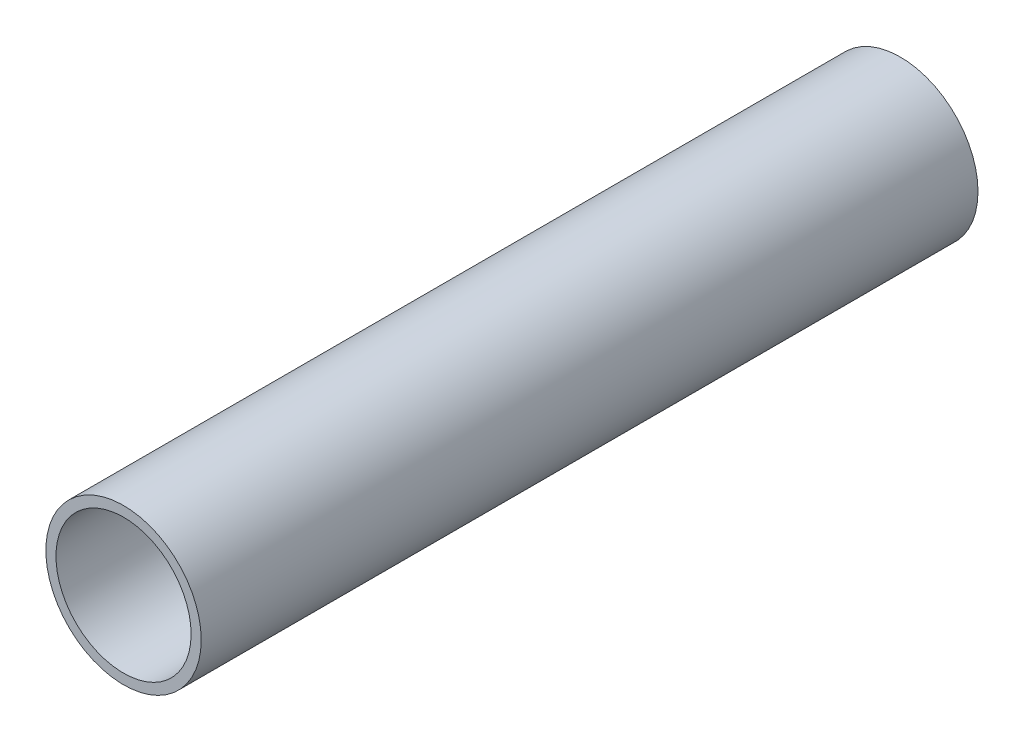
from build123d import *

# Parameters (mm, degrees)
BOSS_EXTRUDE1_DEPTH      = 50.8
BOSS_EXTRUDE1_DEPTH_BACK = 76.2
SKETCH3_R                = 12.7
SKETCH3_R_2              = 11.049


with BuildPart() as part:
    # Sketch3 → Boss-Extrude1 (new, two sides: drawn at the far end of the back side and taken through both)
    with BuildSketch(Plane.XY.offset(-BOSS_EXTRUDE1_DEPTH_BACK)):
        Circle(SKETCH3_R)
        Circle(SKETCH3_R_2, mode=Mode.SUBTRACT)
    extrude(amount=BOSS_EXTRUDE1_DEPTH + BOSS_EXTRUDE1_DEPTH_BACK)


solid = part.part
